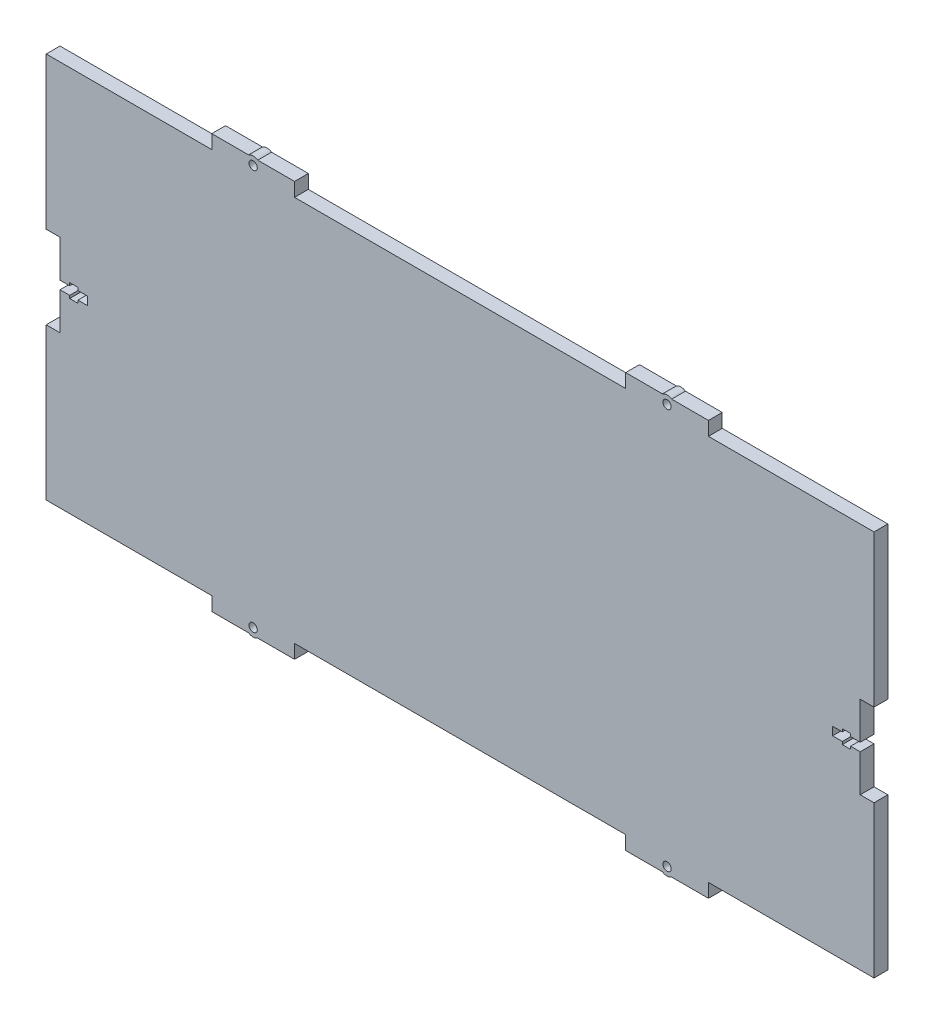
from build123d import *

# Parameters (mm, degrees)
ESQUISSE1_R             = 1.5
BOSS_EXTRU_2_DEPTH      = 5
ESQUISSE2_W             = 5
ESQUISSE2_H             = 140
BOSS_EXTRU_3_DEPTH      = 5
ESQUISSE3_W             = 5
ESQUISSE3_H             = 140
BOSS_EXTRU_4_DEPTH      = 5
ESQUISSE4_W             = 3.5
ESQUISSE4_H             = 3
ESQUISSE4_W_2           = 3
ESQUISSE4_H_2           = 1
ENL_V_MAT_EXTRU_1_DEPTH = 10


with BuildPart() as part:
    # Esquisse1 → Boss.-Extru.2 (new body)
    with BuildSketch(Plane.XY):
        with BuildLine():
            Line((-160.623123651, 88.85383225), (-160.623123651, -51.14616775))
            Line((-160.623123651, -51.14616775), (-105.623123651, -51.14616775))
            Line((-105.623123651, -51.14616775), (-105.623123651, -56.14616775))
            Line((-105.623123651, -56.14616775), (-92.281436046, -56.14616775))
            ThreePointArc((-92.281436046, -56.14616775), (-90.623123651, -56.64616775), (-88.964811256, -56.14616775))
            Line((-88.964811256, -56.14616775), (-75.623123651, -56.14616775))
            Line((-75.623123651, -56.14616775), (-75.623123651, -51.14616775))
            Line((-75.623123651, -51.14616775), (44.376876349, -51.14616775))
            Line((44.376876349, -51.14616775), (44.376876349, -56.14616775))
            Line((44.376876349, -56.14616775), (57.718563954, -56.14616775))
            ThreePointArc((57.718563954, -56.14616775), (59.376876349, -56.64616775), (61.035188744, -56.14616775))
            Line((61.035188744, -56.14616775), (74.376876349, -56.14616775))
            Line((74.376876349, -56.14616775), (74.376876349, -51.14616775))
            Line((74.376876349, -51.14616775), (129.376876349, -51.14616775))
            Line((129.376876349, -51.14616775), (129.376876349, 88.85383225))
            Line((129.376876349, 88.85383225), (74.376876349, 88.85383225))
            Line((74.376876349, 88.85383225), (74.376876349, 93.85383225))
            Line((74.376876349, 93.85383225), (61.035188744, 93.85383225))
            ThreePointArc((61.035188744, 93.85383225), (59.376876349, 94.35383225), (57.718563954, 93.85383225))
            Line((57.718563954, 93.85383225), (44.376876349, 93.85383225))
            Line((44.376876349, 93.85383225), (44.376876349, 88.85383225))
            Line((44.376876349, 88.85383225), (-75.623123651, 88.85383225))
            Line((-75.623123651, 88.85383225), (-75.623123651, 93.85383225))
            Line((-75.623123651, 93.85383225), (-88.964811256, 93.85383225))
            ThreePointArc((-88.964811256, 93.85383225), (-90.623123651, 94.35383225), (-92.281436046, 93.85383225))
            Line((-92.281436046, 93.85383225), (-105.623123651, 93.85383225))
            Line((-105.623123651, 93.85383225), (-105.623123651, 88.85383225))
            Line((-105.623123651, 88.85383225), (-160.623123651, 88.85383225))
        make_face()
        with Locations((-90.623123651, -53.64616775)):
            Circle(ESQUISSE1_R, mode=Mode.SUBTRACT)
        with Locations((59.376876349, -53.64616775)):
            Circle(ESQUISSE1_R, mode=Mode.SUBTRACT)
        with Locations((-90.623123651, 91.35383225)):
            Circle(ESQUISSE1_R, mode=Mode.SUBTRACT)
        with Locations((59.376876349, 91.35383225)):
            Circle(ESQUISSE1_R, mode=Mode.SUBTRACT)
    extrude(amount=BOSS_EXTRU_2_DEPTH)

    # Esquisse2 → Boss.-Extru.3 (add)
    with BuildSketch(Plane.ZY.offset(160.623123651)):
        with Locations((2.5, 18.85383225)):
            Rectangle(ESQUISSE2_W, ESQUISSE2_H)
    extrude(amount=BOSS_EXTRU_3_DEPTH)

    # Esquisse3 → Boss.-Extru.4 (add)
    with BuildSketch(Plane(origin=(129.376876349, 0, 0), x_dir=(0, 0, -1), z_dir=(1, 0, 0))):
        with Locations((-2.5, 18.85383225)):
            Rectangle(ESQUISSE3_W, ESQUISSE3_H)
    extrude(amount=BOSS_EXTRU_4_DEPTH)

    # Esquisse4 → Enlèv. mat.-Extru.1 (cut)
    with BuildSketch(Plane.XY.offset(5)):
        Polygon((-165.623123651, 33.85383225), (-165.623123651, 3.85383225), (-160.623123651, 3.85383225), (-160.623123651, 17.35383225), (-160.623123651, 20.35383225), (-160.623123651, 33.85383225), align=None)
        with Locations((-158.873123651, 18.85383225)):
            Rectangle(ESQUISSE4_W, ESQUISSE4_H)
        with Locations((-155.623123651, 18.85383225)):
            Rectangle(ESQUISSE4_W_2, ESQUISSE4_H)
        with Locations((-155.623123651, 20.85383225)):
            Rectangle(ESQUISSE4_W_2, ESQUISSE4_H_2)
        with Locations((-155.623123651, 16.85383225)):
            Rectangle(ESQUISSE4_W_2, ESQUISSE4_H_2)
        with Locations((-152.373123651, 18.85383225)):
            Rectangle(ESQUISSE4_W, ESQUISSE4_H)
        Polygon((129.376876349, 20.35383225), (129.376876349, 17.35383225), (129.376876349, 3.85383225), (134.376876349, 3.85383225), (134.376876349, 33.85383225), (129.376876349, 33.85383225), align=None)
        with Locations((127.626876349, 18.85383225)):
            Rectangle(ESQUISSE4_W, ESQUISSE4_H)
        with Locations((124.376876349, 18.85383225)):
            Rectangle(ESQUISSE4_W_2, ESQUISSE4_H)
        with Locations((124.376876349, 20.85383225)):
            Rectangle(ESQUISSE4_W_2, ESQUISSE4_H_2)
        with Locations((124.376876349, 16.85383225)):
            Rectangle(ESQUISSE4_W_2, ESQUISSE4_H_2)
        with Locations((121.126876349, 18.85383225)):
            Rectangle(ESQUISSE4_W, ESQUISSE4_H)
    extrude(amount=-ENL_V_MAT_EXTRU_1_DEPTH, mode=Mode.SUBTRACT)


solid = part.part
